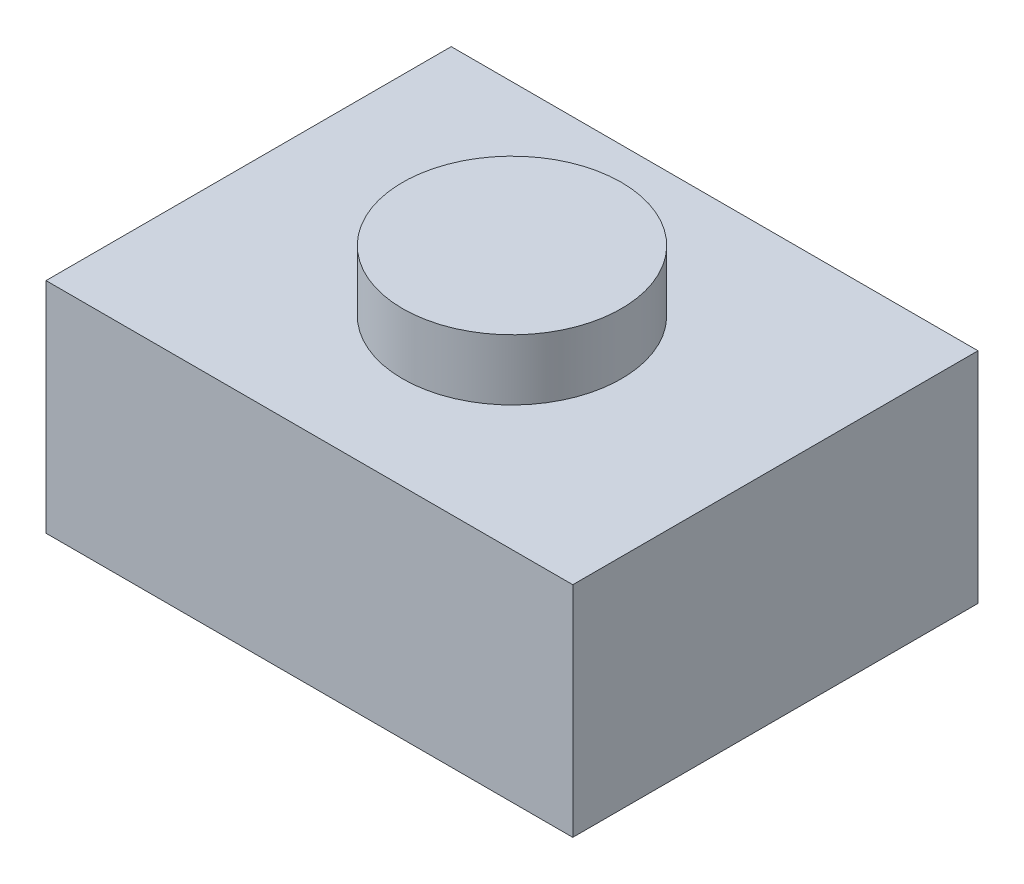
from build123d import *

# Parameters (mm, degrees)
SKETCH1_W           = 3.302
SKETCH1_H           = 2.54
BOSS_EXTRUDE1_DEPTH = 1.3716
SKETCH2_R           = 0.6858
BOSS_EXTRUDE2_DEPTH = 0.381


with BuildPart() as part:
    # Sketch1 → Boss-Extrude1 (new body)
    with BuildSketch(Plane(origin=(0, 0, 0), x_dir=(1, 0, 0), z_dir=(0, 1, 0))):
        with Locations((1.651, 1.27)):
            Rectangle(SKETCH1_W, SKETCH1_H)
    extrude(amount=BOSS_EXTRUDE1_DEPTH)

    # Sketch2 → Boss-Extrude2 (add)
    with BuildSketch(Plane(origin=(0, 1.3716, 0), x_dir=(1, 0, 0), z_dir=(0, 1, 0))):
        with Locations(Location((1.651, 1.27, 0), (0, 0, 90))):
            Circle(SKETCH2_R)
    extrude(amount=BOSS_EXTRUDE2_DEPTH)


solid = part.part
